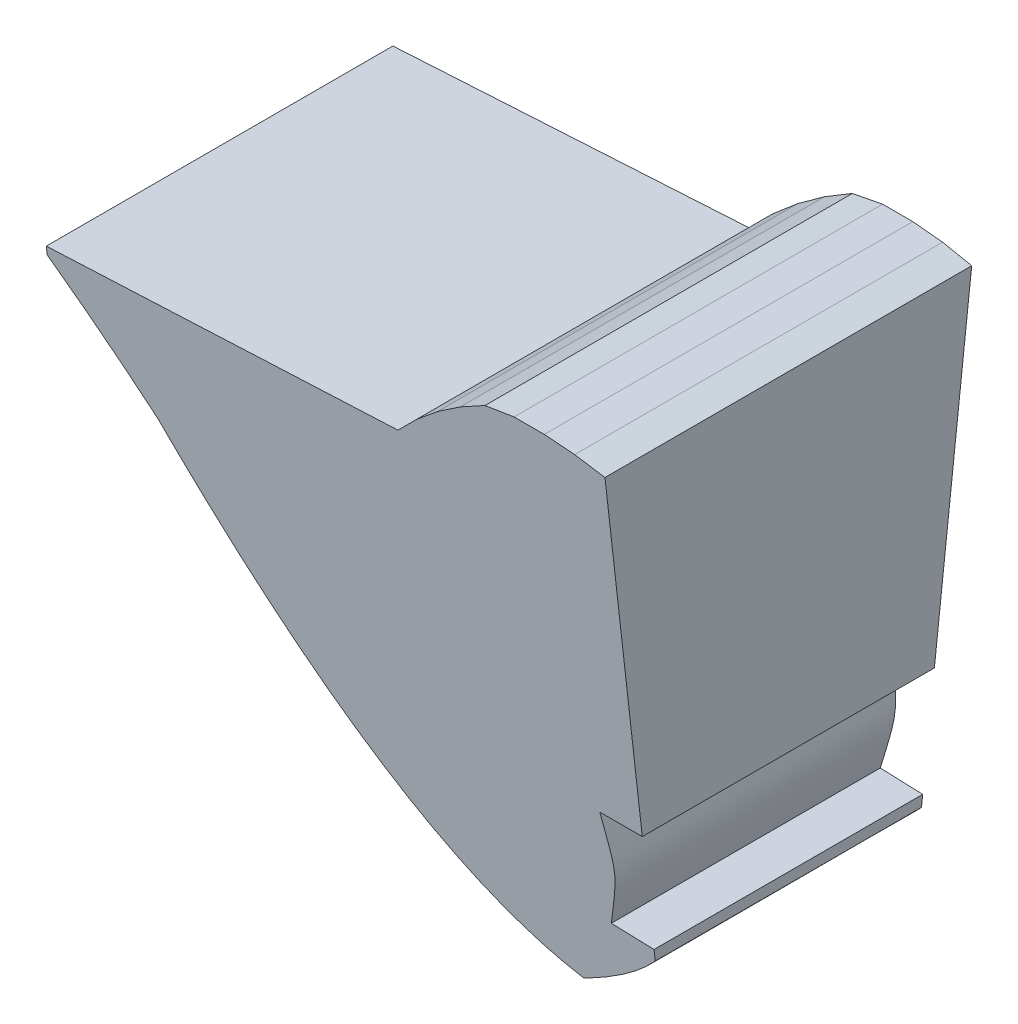
from build123d import *

# Parameters (mm, degrees)
SALIENTE_EXTRUIR1_DEPTH             = 7.21
SALIENTE_EXTRUIR2_DEPTH             = 7.21
SALIENTE_EXTRUIR2_DEPTH_BACK        = 7.21
CORTAR_EXTRUIR2_DEPTH               = 28.232395202
CORTAR_EXTRUIR2_DEPTH_BACK          = 28.232395202
SALIENTE_EXTRUIR3_REACH             = 29.232
SALIENTE_EXTRUIR3_DIRECTION_2_REACH = 29.232


with BuildPart() as part:
    # Croquis1 → Saliente-Extruir1 (new, symmetric)
    with BuildSketch(Plane.XY):
        with BuildLine():
            add(Edge.make_bspline(
                [(-18.945192114, 7.540918896), (-10.215008384, -3.697644103), (-2.846604825, -5.059081104)],
                knots=[0.497667241, 0.497667241, 0.497667241, 0.49955428, 0.49955428, 0.49955428], degree=2, weights=[1, 1, 1]))
            add(Edge.make_bspline(
                [(-2.846604825, -5.059081104), (-0.742366882, -3.9352066), (0.355125, -2.723253227)],
                knots=[0.498812075, 0.498812075, 0.498812075, 0.499412845, 0.499412845, 0.499412845], degree=2, weights=[1, 1, 1]))
            Line((0.355125, -2.723253227), (0.355125, -2.284841781))
            Line((0.355125, -2.284841781), (-1.394875, -2.223730435))
            add(Edge.make_bspline(
                [(-1.394875, -2.223730435), (-0.90753067, -0.123730435), (-1.394875, 1.976269565)],
                knots=[0, 0, 0, 1, 1, 1], degree=2, weights=[1, 3.231801219, 1]))
            Line((-1.394875, 1.976269565), (0.355125, 2.284841781))
            Line((0.355125, 2.284841781), (0.355125, 3.001549529))
            add(Edge.make_bspline(
                [(0.355125, 3.001549529), (-1.44872627, 6.058427314), (-6.994875026, 10.477389992)],
                knots=[0.500820705, 0.500820705, 0.500820705, 0.502013312, 0.502013312, 0.502013312], degree=2, weights=[1, 1, 1]))
            Line((-6.994875026, 10.477389992), (-8.981845695, 12.608155172))
            Line((-8.981845695, 12.608155172), (-23.035921146, 11.871612288))
            Line((-23.035921146, 11.871612288), (-23.035921146, 11.54013782))
            ThreePointArc((-23.035921146, 11.54013782), (-20.949684518, 9.582335705), (-18.945192114, 7.540918896))
        make_face()
    extrude(amount=SALIENTE_EXTRUIR1_DEPTH, both=True)

    # Croquis4 → Saliente-Extruir2 (add, two sides: drawn at the far end of the back side and taken through both)
    with BuildSketch(Plane.XY.offset(-SALIENTE_EXTRUIR2_DEPTH_BACK)):
        Polygon((-1.394875, 1.976269565), (0.355125, 2.284841781), (0.355125, 1.976269565), align=None)
    extrude(amount=SALIENTE_EXTRUIR2_DEPTH + SALIENTE_EXTRUIR2_DEPTH_BACK)

    # Croquis6 → Cortar-Extruir2 (cut, two sides: drawn at the far end of the back side and taken through both)
    with BuildSketch(Plane(origin=(0, 0, 0), x_dir=(0, 0, -1), z_dir=(1, 0, 0)).offset(-CORTAR_EXTRUIR2_DEPTH_BACK)):
        Polygon((7.21, 12.608155172), (7.21, -5.059081104), (5.21, -5.059081104), align=None)
        Polygon((-7.21, 12.608155172), (-7.21, -5.059081104), (-5.21, -5.059081104), align=None)
    extrude(amount=CORTAR_EXTRUIR2_DEPTH + CORTAR_EXTRUIR2_DEPTH_BACK, mode=Mode.SUBTRACT)

    # Saliente-Extruir3: up to this plane
    saliente_extruir3_end = Plane(origin=(-23.035921146, 12.608155172, 7.21), z_dir=(0, 0.1124854344122626, -0.9936533736897816))
    # Croquis8 → Saliente-Extruir3 (add, up to the surface)
    with BuildSketch(Plane.XY, mode=Mode.PRIVATE) as saliente_extruir3_sk1:
        with BuildLine():
            Line((0.355125, 3.001549529), (0.355125, 15.533801407))
            Line((0.355125, 15.533801407), (-0.867166635, 15.749324401))
            Line((-0.867166635, 15.749324401), (-2.103591148, 15.857497529))
            Line((-2.103591148, 15.857497529), (-3.344738602, 15.857497529))
            Line((-3.344738602, 15.857497529), (-4.567030238, 15.641974535))
            Line((-4.567030238, 15.641974535), (-5.641895462, 15.021400808))
            Line((-5.641895462, 15.021400808), (-6.658583937, 14.309507875))
            Line((-6.658583937, 14.309507875), (-7.609358047, 13.51171367))
            Line((-7.609358047, 13.51171367), (-8.486981828, 12.634089889))
            Line((-8.486981828, 12.634089889), (-9.726428332, 12.56913325))
            add(Edge.make_bspline(
                [(-9.726428332, 12.56913325), (-1.861127424, 6.757298639), (0.355125, 3.001549529)],
                knots=[0.500548048, 0.500548048, 0.500548048, 0.502013312, 0.502013312, 0.502013312], degree=2, weights=[1, 1, 1]))
        make_face()
    saliente_extruir3_tool1 = split(extrude(saliente_extruir3_sk1.sketch, amount=SALIENTE_EXTRUIR3_REACH, mode=Mode.PRIVATE), bisect_by=saliente_extruir3_end, keep=Keep.BOTH, mode=Mode.PRIVATE)
    add(saliente_extruir3_tool1.solids().sort_by_distance((-3.011439, 11.135227, 0))[0])

    # Saliente-Extruir3 direction 2: up to this plane
    saliente_extruir3_direction_2_end = Plane(origin=(-23.035921146, 12.608155172, -7.21), z_dir=(0, 0.1124854344122626, 0.9936533736897816))
    # Croquis8 → Saliente-Extruir3 direction 2 (add, up to the surface)
    with BuildSketch(Plane.XY, mode=Mode.PRIVATE) as saliente_extruir3_direction_2_sk1:
        with BuildLine():
            Line((0.355125, 3.001549529), (0.355125, 15.533801407))
            Line((0.355125, 15.533801407), (-0.867166635, 15.749324401))
            Line((-0.867166635, 15.749324401), (-2.103591148, 15.857497529))
            Line((-2.103591148, 15.857497529), (-3.344738602, 15.857497529))
            Line((-3.344738602, 15.857497529), (-4.567030238, 15.641974535))
            Line((-4.567030238, 15.641974535), (-5.641895462, 15.021400808))
            Line((-5.641895462, 15.021400808), (-6.658583937, 14.309507875))
            Line((-6.658583937, 14.309507875), (-7.609358047, 13.51171367))
            Line((-7.609358047, 13.51171367), (-8.486981828, 12.634089889))
            Line((-8.486981828, 12.634089889), (-9.726428332, 12.56913325))
            add(Edge.make_bspline(
                [(-9.726428332, 12.56913325), (-1.861127424, 6.757298639), (0.355125, 3.001549529)],
                knots=[0.500548048, 0.500548048, 0.500548048, 0.502013312, 0.502013312, 0.502013312], degree=2, weights=[1, 1, 1]))
        make_face()
    saliente_extruir3_direction_2_tool1 = split(extrude(saliente_extruir3_direction_2_sk1.sketch, amount=-SALIENTE_EXTRUIR3_DIRECTION_2_REACH, mode=Mode.PRIVATE), bisect_by=saliente_extruir3_direction_2_end, keep=Keep.BOTH, mode=Mode.PRIVATE)
    add(saliente_extruir3_direction_2_tool1.solids().sort_by_distance((-3.011439, 11.135227, 0))[0])


solid = part.part
